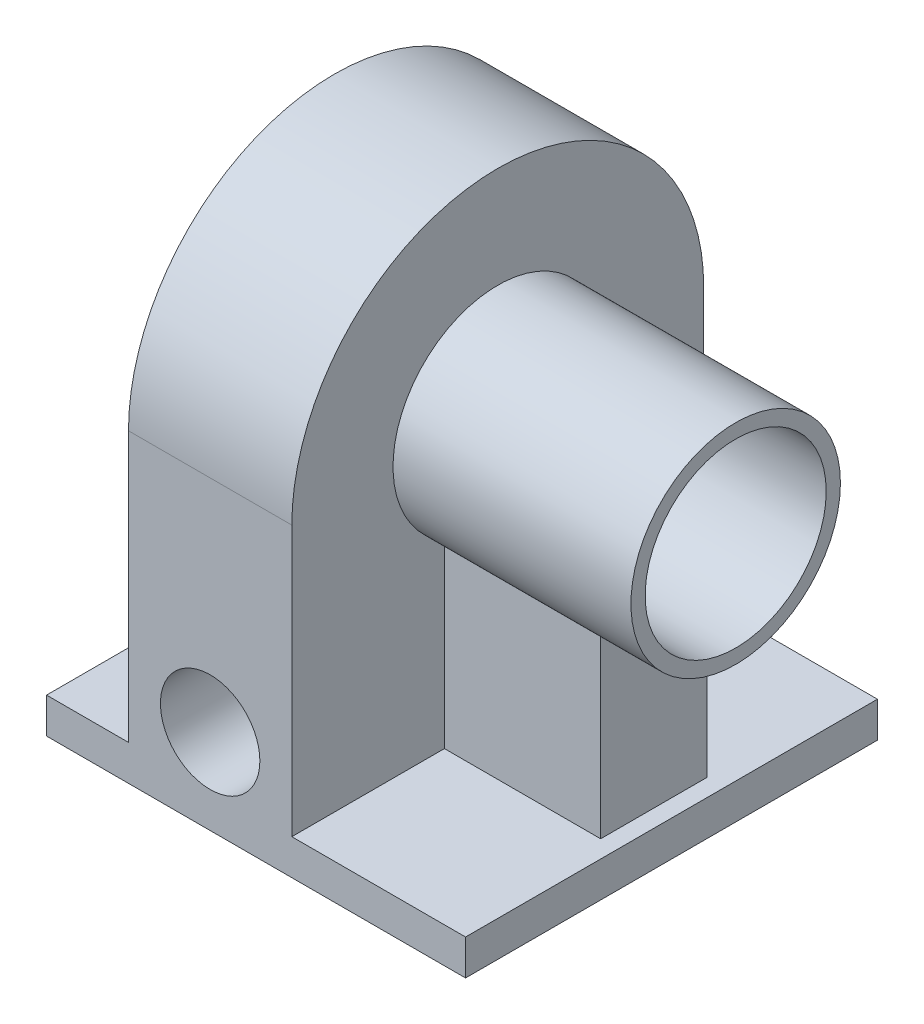
from build123d import *

# Parameters (mm, degrees)
SKETCH1_W           = 118
SKETCH1_H           = 10
BOSS_EXTRUDE1_DEPTH = 116
BOSS_EXTRUDE2_DEPTH = 46
SKETCH3_R           = 14
CUT_EXTRUDE1_DEPTH  = 195.117634996
SKETCH4_R           = 29.5
SKETCH4_R_2         = 25.5
BOSS_EXTRUDE3_DEPTH = 67
SKETCH6_W           = 44
SKETCH6_H           = 30
BOSS_EXTRUDE4_DEPTH = 55
CUT_EXTRUDE2_START  = -44
CUT_EXTRUDE2_DEPTH  = 44


with BuildPart() as part:
    # Sketch1 → Boss-Extrude1 (new body)
    with BuildSketch(Plane.XY):
        with Locations((-0.073312219, 5)):
            Rectangle(SKETCH1_W, SKETCH1_H)
    extrude(amount=-BOSS_EXTRUDE1_DEPTH)

    # Sketch2 → Boss-Extrude2 (add)
    with BuildSketch(Plane(origin=(10, 0, 0), x_dir=(0, 0, -1), z_dir=(1, 0, 0))):
        with BuildLine():
            Line((0, 86), (0, 10))
            Line((0, 10), (116, 10))
            Line((116, 10), (116, 86))
            ThreePointArc((116, 86), (58, 144), (0, 86))
        make_face()
    extrude(amount=-BOSS_EXTRUDE2_DEPTH)

    # Sketch3 → Cut-Extrude1 (cut, through all)
    with BuildSketch(Plane.XY):
        with Locations((-13, 24)):
            Circle(SKETCH3_R)
    extrude(amount=-CUT_EXTRUDE1_DEPTH, mode=Mode.SUBTRACT)

    # Sketch4 → Boss-Extrude3 (add)
    with BuildSketch(Plane(origin=(10, 0, 0), x_dir=(0, 0, -1), z_dir=(1, 0, 0))):
        with Locations((58, 86)):
            Circle(SKETCH4_R)
        with Locations((58, 86)):
            Circle(SKETCH4_R_2, mode=Mode.SUBTRACT)
    extrude(amount=BOSS_EXTRUDE3_DEPTH)

    # Sketch6 → Boss-Extrude4 (add)
    with BuildSketch(Plane(origin=(0, 10, 0), x_dir=(1, 0, 0), z_dir=(0, 1, 0))):
        with Locations((32, 57.975103421)):
            Rectangle(SKETCH6_W, SKETCH6_H)
    extrude(amount=BOSS_EXTRUDE4_DEPTH)

    # Sketch7 → Cut-Extrude2 (cut)
    with BuildSketch(Plane(origin=(54, 0, 0), x_dir=(0, 0, -1), z_dir=(1, 0, 0)).offset(CUT_EXTRUDE2_START)):
        with BuildLine():
            Line((43.534523859, 65), (72.465476141, 65))
            ThreePointArc((72.465476141, 65), (58, 60.5), (43.534523859, 65))
        make_face()
    extrude(amount=CUT_EXTRUDE2_DEPTH, mode=Mode.SUBTRACT)


solid = part.part
